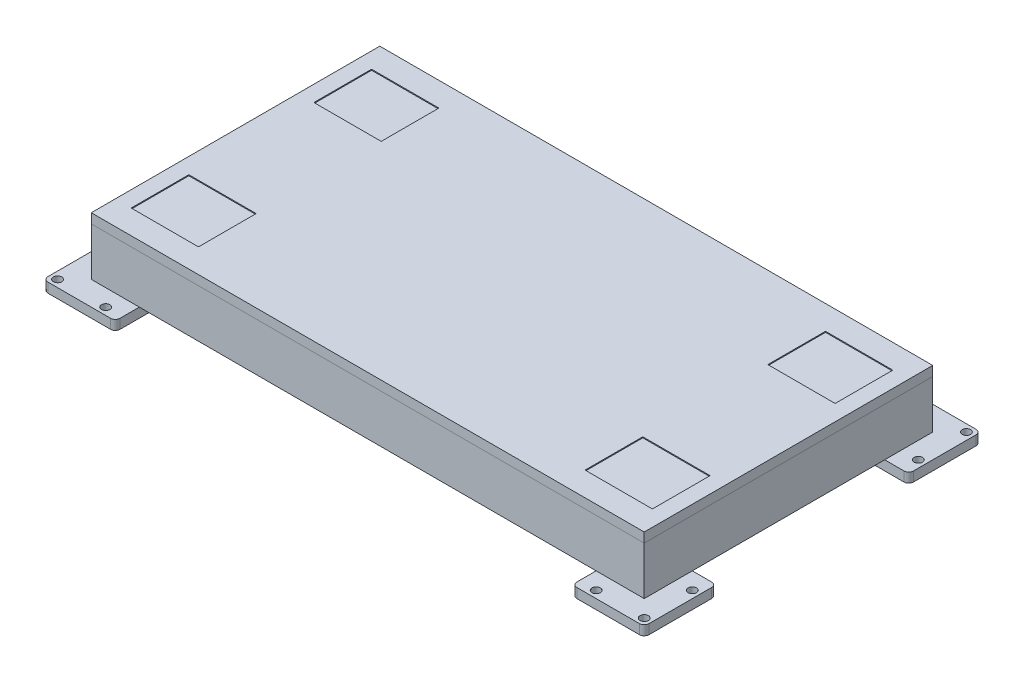
from build123d import *

# Parameters (mm, degrees)
C_CHANNEL_100_X_10_2_DEPTH      = 712.803398875
C_CHANNEL_100_X_10_2_DEPTH_BACK = 112.803398875
C_CHANNEL_100_X_10_2_2_DEPTH    = 1375.60679775
C_CHANNEL_100_X_10_2_3_DEPTH    = 825.60679775
C_CHANNEL_100_X_10_2_4_DEPTH    = 1375.60679775
SKETCH13_W                      = 1150
SKETCH13_H                      = 600
BOSS_EXTRUDE1_DEPTH             = 20
SKETCH14_R                      = 8.75
BOSS_EXTRUDE2_DEPTH             = 20
BOSS_EXTRUDE2_2_DEPTH           = 20
BOSS_EXTRUDE2_3_DEPTH           = 20
BOSS_EXTRUDE2_4_DEPTH           = 20
SKETCH15_W                      = 140
SKETCH15_H                      = 120
CUT_EXTRUDE1_DEPTH              = 2
MIRROR2_COPY_1_SKETCH_W         = 140
MIRROR2_COPY_1_SKETCH_H         = 120
MIRROR2_COPY_1_DEPTH            = 2


with BuildPart() as part:
    # Sketch12 → C channel 100 X 10(2) (new, two sides: drawn at the far end of the back side and taken through both)
    with BuildSketch(Plane(origin=(-575, 0, 300), x_dir=(1, 0, 0), z_dir=(0, 0, -1)).offset(-C_CHANNEL_100_X_10_2_DEPTH_BACK)):
        with BuildLine():
            Line((50, 100), (0, 100))
            Line((0, 100), (0, 0))
            Line((0, 0), (50, 0))
            Line((50, 0), (50, 1.629852671))
            ThreePointArc((50, 1.629852671), (48.844151715, 4.6409404), (45.970378085, 6.1052012))
            Line((45.970378085, 6.1052012), (13.063772294, 9.563824837))
            ThreePointArc((13.063772294, 9.563824837), (7.954841396, 12.166955149), (5.9, 17.52))
            Line((5.9, 17.52), (5.9, 82.48))
            ThreePointArc((5.9, 82.48), (7.954841396, 87.833044851), (13.063772294, 90.436175163))
            Line((13.063772294, 90.436175163), (45.970378085, 93.8947988))
            ThreePointArc((45.970378085, 93.8947988), (48.844151715, 95.3590596), (50, 98.370147329))
            Line((50, 98.370147329), (50, 100))
        make_face()
    extrude(amount=C_CHANNEL_100_X_10_2_DEPTH + C_CHANNEL_100_X_10_2_DEPTH_BACK)

    # C channel 100 X 10(2) mitre 1
    split(bisect_by=Plane(origin=(-575, 0, 300), x_dir=(0, -1, 0), z_dir=(-0.707106781, 0, -0.707106781)), keep=Keep.TOP)

    # C channel 100 X 10(2) mitre 2
    split(bisect_by=Plane(origin=(-575, 0, -300), x_dir=(0, -1, 0), z_dir=(-0.707106781, 0, 0.707106781)), keep=Keep.TOP)


with BuildPart() as body_2:
    # Sketch12 on segment 2 (carried to segment 2) → C channel 100 X 10_2 2 (new body)
    with BuildSketch(Plane(origin=(-687.803398875, 0, -300), x_dir=(0, 0, 1), z_dir=(1, 0, 0))):
        with BuildLine():
            Line((50, 100), (0, 100))
            Line((0, 100), (0, 0))
            Line((0, 0), (50, 0))
            Line((50, 0), (50, 1.629852671))
            ThreePointArc((50, 1.629852671), (48.844151715, 4.6409404), (45.970378085, 6.1052012))
            Line((45.970378085, 6.1052012), (13.063772294, 9.563824837))
            ThreePointArc((13.063772294, 9.563824837), (7.954841396, 12.166955149), (5.9, 17.52))
            Line((5.9, 17.52), (5.9, 82.48))
            ThreePointArc((5.9, 82.48), (7.954841396, 87.833044851), (13.063772294, 90.436175163))
            Line((13.063772294, 90.436175163), (45.970378085, 93.8947988))
            ThreePointArc((45.970378085, 93.8947988), (48.844151715, 95.3590596), (50, 98.370147329))
            Line((50, 98.370147329), (50, 100))
        make_face()
    extrude(amount=C_CHANNEL_100_X_10_2_2_DEPTH)

    # C channel 100 X 10_2 2 mitre 1
    split(bisect_by=Plane(origin=(-575, 0, -300), x_dir=(0, 1, 0), z_dir=(0.707106781, 0, -0.707106781)), keep=Keep.TOP)

    # C channel 100 X 10_2 2 mitre 2
    split(bisect_by=Plane(origin=(575, 0, -300), x_dir=(0, -1, 0), z_dir=(-0.707106781, 0, -0.707106781)), keep=Keep.TOP)


with BuildPart() as body_3:
    # Sketch12 on segment 3 (carried to segment 3) → C channel 100 X 10_2 3 (new body)
    with BuildSketch(Plane(origin=(575, 0, -412.803398875), x_dir=(-1, 0, 0), z_dir=(0, 0, 1))):
        with BuildLine():
            Line((50, 100), (0, 100))
            Line((0, 100), (0, 0))
            Line((0, 0), (50, 0))
            Line((50, 0), (50, 1.629852671))
            ThreePointArc((50, 1.629852671), (48.844151715, 4.6409404), (45.970378085, 6.1052012))
            Line((45.970378085, 6.1052012), (13.063772294, 9.563824837))
            ThreePointArc((13.063772294, 9.563824837), (7.954841396, 12.166955149), (5.9, 17.52))
            Line((5.9, 17.52), (5.9, 82.48))
            ThreePointArc((5.9, 82.48), (7.954841396, 87.833044851), (13.063772294, 90.436175163))
            Line((13.063772294, 90.436175163), (45.970378085, 93.8947988))
            ThreePointArc((45.970378085, 93.8947988), (48.844151715, 95.3590596), (50, 98.370147329))
            Line((50, 98.370147329), (50, 100))
        make_face()
    extrude(amount=C_CHANNEL_100_X_10_2_3_DEPTH)

    # C channel 100 X 10_2 3 mitre 1
    split(bisect_by=Plane(origin=(575, 0, 300), x_dir=(0, 1, 0), z_dir=(0.707106781, 0, -0.707106781)), keep=Keep.TOP)

    # C channel 100 X 10_2 3 mitre 2
    split(bisect_by=Plane(origin=(575, 0, -300), x_dir=(0, 1, 0), z_dir=(0.707106781, 0, 0.707106781)), keep=Keep.TOP)


with BuildPart() as body_4:
    # Sketch12 on segment 4 (carried to segment 4) → C channel 100 X 10_2 4 (new body)
    with BuildSketch(Plane(origin=(687.803398875, 0, 300), x_dir=(0, 0, -1), z_dir=(-1, 0, 0))):
        with BuildLine():
            Line((50, 100), (0, 100))
            Line((0, 100), (0, 0))
            Line((0, 0), (50, 0))
            Line((50, 0), (50, 1.629852671))
            ThreePointArc((50, 1.629852671), (48.844151715, 4.6409404), (45.970378085, 6.1052012))
            Line((45.970378085, 6.1052012), (13.063772294, 9.563824837))
            ThreePointArc((13.063772294, 9.563824837), (7.954841396, 12.166955149), (5.9, 17.52))
            Line((5.9, 17.52), (5.9, 82.48))
            ThreePointArc((5.9, 82.48), (7.954841396, 87.833044851), (13.063772294, 90.436175163))
            Line((13.063772294, 90.436175163), (45.970378085, 93.8947988))
            ThreePointArc((45.970378085, 93.8947988), (48.844151715, 95.3590596), (50, 98.370147329))
            Line((50, 98.370147329), (50, 100))
        make_face()
    extrude(amount=C_CHANNEL_100_X_10_2_4_DEPTH)

    # C channel 100 X 10_2 4 mitre 1
    split(bisect_by=Plane(origin=(-575, 0, 300), x_dir=(0, 1, 0), z_dir=(0.707106781, 0, 0.707106781)), keep=Keep.TOP)

    # C channel 100 X 10_2 4 mitre 2
    split(bisect_by=Plane(origin=(575, 0, 300), x_dir=(0, -1, 0), z_dir=(-0.707106781, 0, 0.707106781)), keep=Keep.TOP)


with BuildPart() as body_5:
    # Sketch13 → Boss-Extrude1 (new body)
    with BuildSketch(Plane(origin=(0, 0, 0), x_dir=(1, 0, 0), z_dir=(0, 1, 0))):
        Rectangle(SKETCH13_W, SKETCH13_H)
    extrude(amount=BOSS_EXTRUDE1_DEPTH)

    # Sketch15 → Cut-Extrude1 (cut)
    with BuildSketch(Plane(origin=(0, 20, 0), x_dir=(1, 0, 0), z_dir=(0, 1, 0))):
        with Locations((-472, 190)):
            Rectangle(SKETCH15_W, SKETCH15_H)
    cut_extrude1 = extrude(amount=-CUT_EXTRUDE1_DEPTH, mode=Mode.SUBTRACT)

    # Mirror1: Cut-Extrude1 across plane
    add(cut_extrude1.mirror(Plane(origin=(0, 0, 0), x_dir=(0, 0, 1), z_dir=(1, 0, 0))), mode=Mode.SUBTRACT)

    # Mirror2: Cut-Extrude1 across plane
    add(cut_extrude1.mirror(Plane.XY), mode=Mode.SUBTRACT)

    # Mirror2 copy 1 sketch → Mirror2 copy 1 (cut)
    with BuildSketch(Plane(origin=(0, 20, 0), x_dir=(-1, 0, 0), z_dir=(0, 1, 0))):
        with Locations((-472, 190)):
            Rectangle(MIRROR2_COPY_1_SKETCH_W, MIRROR2_COPY_1_SKETCH_H)
    extrude(amount=-MIRROR2_COPY_1_DEPTH, mode=Mode.SUBTRACT)


with BuildPart() as body_6:
    # Sketch14 → Boss-Extrude2 (new body)
    with BuildSketch(Plane.XZ.offset(100)):
        with BuildLine():
            Line((-615, 350), (-485, 350))
            ThreePointArc((-485, 350), (-477.928932188, 347.071067812), (-475, 340))
            Line((-475, 340), (-475, 210))
            ThreePointArc((-475, 210), (-477.928932188, 202.928932188), (-485, 200))
            Line((-485, 200), (-615, 200))
            ThreePointArc((-615, 200), (-622.071067812, 202.928932188), (-625, 210))
            Line((-625, 210), (-625, 340))
            ThreePointArc((-625, 340), (-622.071067812, 347.071067812), (-615, 350))
        make_face()
        with Locations(Location((-510, 335, 0), (0, 0, 270))):
            Circle(SKETCH14_R, mode=Mode.SUBTRACT)
        with Locations(Location((-610, 335, 0), (0, 0, 270))):
            Circle(SKETCH14_R, mode=Mode.SUBTRACT)
        with Locations(Location((-610, 235, 0), (0, 0, 270))):
            Circle(SKETCH14_R, mode=Mode.SUBTRACT)
    extrude(amount=BOSS_EXTRUDE2_DEPTH)


with BuildPart() as body_7:
    # Sketch14 → Boss-Extrude2 2 (new body)
    with BuildSketch(Plane.XZ.offset(100)):
        with BuildLine():
            Line((475, 340), (475, 210))
            ThreePointArc((475, 210), (477.928932188, 202.928932188), (485, 200))
            Line((485, 200), (615, 200))
            ThreePointArc((615, 200), (622.071067812, 202.928932188), (625, 210))
            Line((625, 210), (625, 340))
            ThreePointArc((625, 340), (622.071067812, 347.071067812), (615, 350))
            Line((615, 350), (485, 350))
            ThreePointArc((485, 350), (477.928932188, 347.071067812), (475, 340))
        make_face()
        with Locations(Location((610, 235, 0), (0, 0, 90))):
            Circle(SKETCH14_R, mode=Mode.SUBTRACT)
        with Locations(Location((610, 335, 0), (0, 0, 90))):
            Circle(SKETCH14_R, mode=Mode.SUBTRACT)
        with Locations(Location((510, 335, 0), (0, 0, 90))):
            Circle(SKETCH14_R, mode=Mode.SUBTRACT)
    extrude(amount=BOSS_EXTRUDE2_2_DEPTH)


with BuildPart() as body_8:
    # Sketch14 → Boss-Extrude2 3 (new body)
    with BuildSketch(Plane.XZ.offset(100)):
        with BuildLine():
            Line((615, -350), (485, -350))
            ThreePointArc((485, -350), (477.928932188, -347.071067812), (475, -340))
            Line((475, -340), (475, -210))
            ThreePointArc((475, -210), (477.928932188, -202.928932188), (485, -200))
            Line((485, -200), (615, -200))
            ThreePointArc((615, -200), (622.071067812, -202.928932188), (625, -210))
            Line((625, -210), (625, -340))
            ThreePointArc((625, -340), (622.071067812, -347.071067812), (615, -350))
        make_face()
        with Locations(Location((510, -335, 0), (0, 0, 270))):
            Circle(SKETCH14_R, mode=Mode.SUBTRACT)
        with Locations(Location((610, -335, 0), (0, 0, 270))):
            Circle(SKETCH14_R, mode=Mode.SUBTRACT)
        with Locations(Location((610, -235, 0), (0, 0, 270))):
            Circle(SKETCH14_R, mode=Mode.SUBTRACT)
    extrude(amount=BOSS_EXTRUDE2_3_DEPTH)


with BuildPart() as body_9:
    # Sketch14 → Boss-Extrude2 4 (new body)
    with BuildSketch(Plane.XZ.offset(100)):
        with BuildLine():
            Line((-475, -340), (-475, -210))
            ThreePointArc((-475, -210), (-477.928932188, -202.928932188), (-485, -200))
            Line((-485, -200), (-615, -200))
            ThreePointArc((-615, -200), (-622.071067812, -202.928932188), (-625, -210))
            Line((-625, -210), (-625, -340))
            ThreePointArc((-625, -340), (-622.071067812, -347.071067812), (-615, -350))
            Line((-615, -350), (-485, -350))
            ThreePointArc((-485, -350), (-477.928932188, -347.071067812), (-475, -340))
        make_face()
        with Locations(Location((-610, -235, 0), (0, 0, 90))):
            Circle(SKETCH14_R, mode=Mode.SUBTRACT)
        with Locations(Location((-610, -335, 0), (0, 0, 90))):
            Circle(SKETCH14_R, mode=Mode.SUBTRACT)
        with Locations(Location((-510, -335, 0), (0, 0, 90))):
            Circle(SKETCH14_R, mode=Mode.SUBTRACT)
    extrude(amount=BOSS_EXTRUDE2_4_DEPTH)


solid = Compound([part.part, body_2.part, body_3.part, body_4.part, body_5.part, body_6.part, body_7.part, body_8.part, body_9.part])
